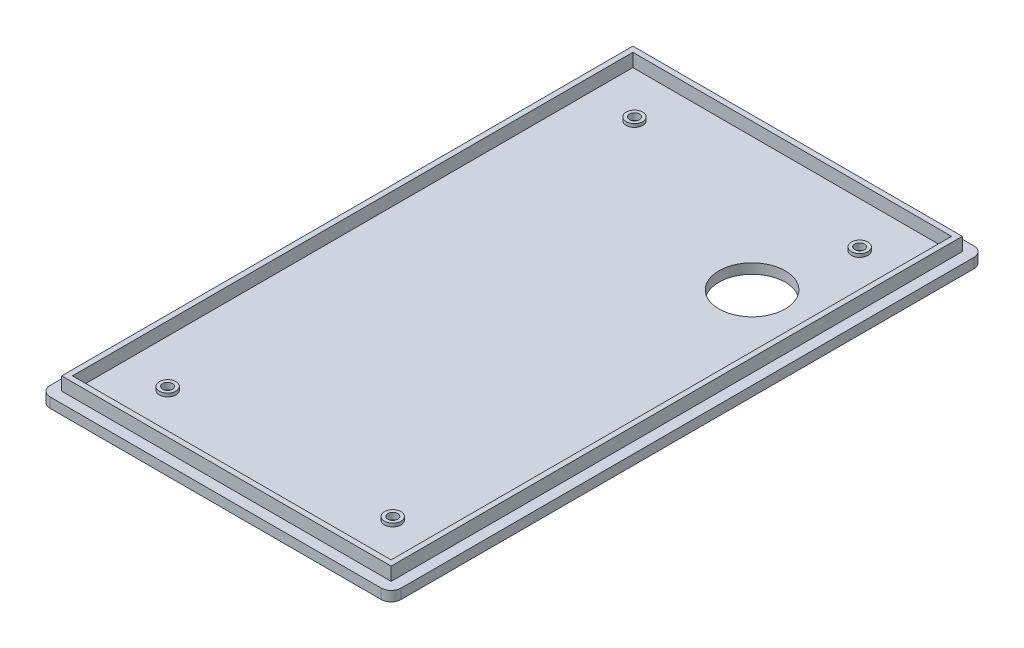
from build123d import *

# Parameters (mm, degrees)
CROQUIS3_W                 = 106
CROQUIS3_H                 = 179
SALIENTE_EXTRUIR4_DEPTH    = 3
CROQUIS3_6_W               = 99.5
CROQUIS3_6_H               = 172.5
CROQUIS3_6_W_2             = 96.25
CROQUIS3_6_H_2             = 169.25
SALIENTE_EXTRUIR5_DEPTH    = 7
CROQUIS7_R                 = 10
CORTAR_EXTRUIR1_DEPTH      = 7
REDONDEO1_R                = 3
CORTAR_EXTRUIR2_DEPTH      = 20
CORTAR_EXTRUIR2_DEPTH_BACK = 20
CROQUIS8_R                 = 1.5
CROQUIS12_R                = 3
CORTAR_EXTRUIR3_DEPTH      = 2
CROQUIS13_R                = 2.5
SALIENTE_EXTRUIR7_DEPTH    = 1
CORTAR_EXTRUIR4_DEPTH      = 1
CORTAR_EXTRUIR4_DEPTH_BACK = 11
CROQUIS14_R                = 1.5


with BuildPart() as part:
    # Croquis3 → Saliente-Extruir4 (new body)
    with BuildSketch(Plane(origin=(0, 0, 0), x_dir=(1, 0, 0), z_dir=(0, 1, 0))):
        Rectangle(CROQUIS3_W, CROQUIS3_H)
    extrude(amount=SALIENTE_EXTRUIR4_DEPTH)

    # Croquis3<6> → Saliente-Extruir5 (add)
    with BuildSketch(Plane(origin=(0, 0, 0), x_dir=(1, 0, 0), z_dir=(0, 1, 0))):
        Rectangle(CROQUIS3_6_W, CROQUIS3_6_H)
        Rectangle(CROQUIS3_6_W_2, CROQUIS3_6_H_2, mode=Mode.SUBTRACT)
    extrude(amount=SALIENTE_EXTRUIR5_DEPTH)

    # Croquis7 → Cortar-Extruir1 (cut)
    with BuildSketch(Plane.XZ):
        with Locations((28, -44.5)):
            Circle(CROQUIS7_R)
    extrude(amount=-CORTAR_EXTRUIR1_DEPTH, mode=Mode.SUBTRACT)

    # Redondeo1
    redondeo1_edges = [part.edges().sort_by_distance(p)[0] for p in [
        (53, 1.5, -89.5),
        (-53, 1.5, -89.5),
        (53, 1.5, 89.5),
        (-53, 1.5, 89.5),
    ]]
    fillet(redondeo1_edges, radius=REDONDEO1_R)

    # Croquis8 → Cortar-Extruir2 (cut, two sides: drawn at the far end of the back side and taken through both)
    with BuildSketch(Plane(origin=(0, 3, 0), x_dir=(1, 0, 0), z_dir=(0, 1, 0)).offset(-CORTAR_EXTRUIR2_DEPTH_BACK)):
        with Locations((-34, 71)):
            Circle(CROQUIS8_R)
        with Locations((34, 71)):
            Circle(CROQUIS8_R)
        with Locations((-34, -70)):
            Circle(CROQUIS8_R)
        with Locations((34, -70)):
            Circle(CROQUIS8_R)
    extrude(amount=CORTAR_EXTRUIR2_DEPTH + CORTAR_EXTRUIR2_DEPTH_BACK, mode=Mode.SUBTRACT)

    # Croquis12 → Cortar-Extruir3 (cut)
    with BuildSketch(Plane.XZ):
        with Locations((-34, 70)):
            Circle(CROQUIS12_R)
        with Locations((34, 70)):
            Circle(CROQUIS12_R)
        with Locations((34, -71)):
            Circle(CROQUIS12_R)
        with Locations((-34, -71)):
            Circle(CROQUIS12_R)
    extrude(amount=-CORTAR_EXTRUIR3_DEPTH, mode=Mode.SUBTRACT)

    # Croquis13 → Saliente-Extruir7 (add)
    with BuildSketch(Plane(origin=(0, 3, 0), x_dir=(1, 0, 0), z_dir=(0, 1, 0))):
        with Locations((-34, 71)):
            Circle(CROQUIS13_R)
        with Locations((34, 71)):
            Circle(CROQUIS13_R)
        with Locations((-34, -70)):
            Circle(CROQUIS13_R)
        with Locations((34, -70)):
            Circle(CROQUIS13_R)
    extrude(amount=SALIENTE_EXTRUIR7_DEPTH)

    # Croquis14 → Cortar-Extruir4 (cut, two sides: drawn at the far end of the back side and taken through both)
    with BuildSketch(Plane.XZ.offset(-CORTAR_EXTRUIR4_DEPTH_BACK)):
        with Locations((-34, 70)):
            Circle(CROQUIS14_R)
        with Locations((34, 70)):
            Circle(CROQUIS14_R)
        with Locations((34, -71)):
            Circle(CROQUIS14_R)
        with Locations((-34, -71)):
            Circle(CROQUIS14_R)
    extrude(amount=CORTAR_EXTRUIR4_DEPTH + CORTAR_EXTRUIR4_DEPTH_BACK, mode=Mode.SUBTRACT)


solid = part.part
